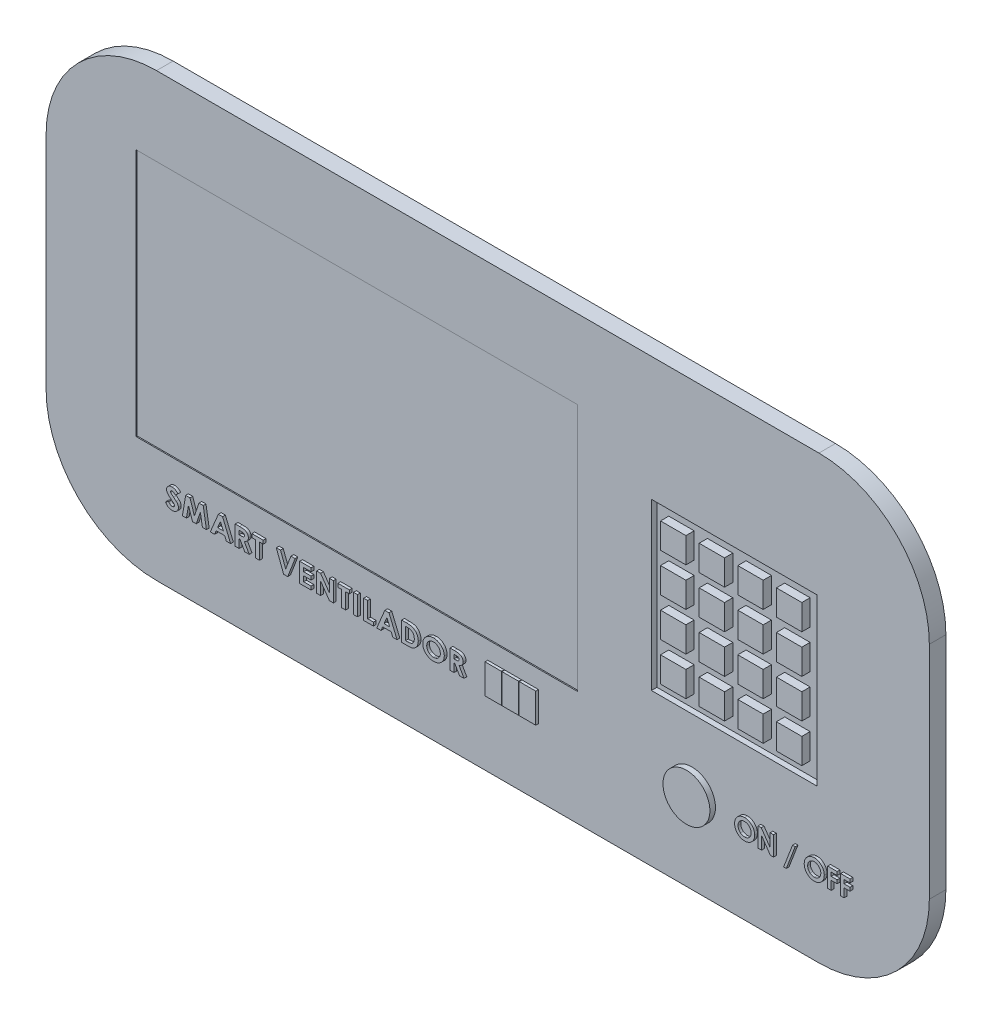
from build123d import *

# Parameters (mm, degrees)
SALIENTE_EXTRUIR1_DEPTH = 3
CROQUIS2_W              = 0.717948718
CROQUIS2_H              = 3.5
SALIENTE_EXTRUIR2_DEPTH = 0.5
SALIENTE_EXTRUIR3_DEPTH = 0.5
CROQUIS4_W              = 3
CROQUIS4_H              = 5.35
SALIENTE_EXTRUIR4_DEPTH = 0.5
CROQUIS5_W              = 80
CROQUIS5_H              = 45
CORTAR_EXTRUIR1_DEPTH   = 0.2
CROQUIS6_R              = 4.25
SALIENTE_EXTRUIR5_DEPTH = 1
CROQUIS7_W              = 30
CROQUIS7_H              = 30
CORTAR_EXTRUIR2_DEPTH   = 1
CROQUIS8_W              = 4.6
CROQUIS8_H              = 4.6
SALIENTE_EXTRUIR6_DEPTH = 1.5


with BuildPart() as part:
    # Croquis1 → Saliente-Extruir1 (new body)
    with BuildSketch(Plane.XY):
        with BuildLine():
            Line((-60, 40), (60, 40))
            ThreePointArc((60, 40), (74.142135624, 34.142135624), (80, 20))
            Line((80, 20), (80, -20))
            ThreePointArc((80, -20), (74.142135624, -34.142135624), (60, -40))
            Line((60, -40), (-60, -40))
            ThreePointArc((-60, -40), (-74.142135624, -34.142135624), (-80, -20))
            Line((-80, -20), (-80, 20))
            ThreePointArc((-80, 20), (-74.142135624, 34.142135624), (-60, 40))
        make_face()
    extrude(amount=SALIENTE_EXTRUIR1_DEPTH)

    # Croquis2 → Saliente-Extruir2 (add)
    # profile 1 of 15: a face of its own
    with BuildSketch(Plane.XY.offset(3)):
        with BuildLine():
            Line((-55.621794872, -23.967648237), (-56.124499199, -24.397435897))
            add(Edge.make_bspline(
                [(-56.124499199, -24.397435897), (-56.146289856, -24.369052903), (-56.188135035, -24.314548283), (-56.25497565, -24.241417992), (-56.321613686, -24.178938925), (-56.389157899, -24.127891339), (-56.457402581, -24.088145818), (-56.525956881, -24.059708882), (-56.594969249, -24.041735408), (-56.641356448, -24.039546945), (-56.664362981, -24.038461538)],
                knots=[0, 0, 0, 0, 1.277318712, 2.45286911, 3.533588782, 4.535065184, 5.46981375, 6.345469513, 7.179407024, 8, 8, 8, 8], degree=3))
            add(Edge.make_bspline(
                [(-56.664362981, -24.038461538), (-56.685708, -24.039134703), (-56.726753785, -24.040429176), (-56.785411939, -24.054125009), (-56.837942834, -24.076617586), (-56.883402375, -24.107395247), (-56.919967376, -24.143408068), (-56.948410812, -24.181892879), (-56.964226243, -24.224287201), (-56.966717538, -24.253360534), (-56.967948718, -24.267728365)],
                knots=[0, 0, 0, 0, 1.217479296, 2.341173553, 3.417477448, 4.465338837, 5.456563799, 6.338062097, 7.178682312, 8, 8, 8, 8], degree=3))
            add(Edge.make_bspline(
                [(-56.967948718, -24.267728365), (-56.967009562, -24.282279816), (-56.965119584, -24.311563489), (-56.953687441, -24.354965153), (-56.933634537, -24.39668002), (-56.915522489, -24.422220823), (-56.90625, -24.435296474)],
                knots=[0, 0, 0, 0, 0.961387754, 1.934718672, 2.942676219, 4, 4, 4, 4], degree=3))
            add(Edge.make_bspline(
                [(-56.90625, -24.435296474), (-56.897475032, -24.445443587), (-56.8773462, -24.468719972), (-56.839966216, -24.505985803), (-56.792711248, -24.551312586), (-56.73411001, -24.603713536), (-56.665633125, -24.664052852), (-56.585804218, -24.73140971), (-56.495945341, -24.806807025), (-56.432106155, -24.859299305), (-56.398637821, -24.88681891)],
                knots=[0, 0, 0, 0, 0.473340372, 1.085791838, 1.861725834, 2.784458208, 3.859937724, 5.082978446, 6.470722139, 8, 8, 8, 8], degree=3))
            add(Edge.make_bspline(
                [(-56.398637821, -24.88681891), (-56.367365202, -24.912346913), (-56.307902408, -24.960886702), (-56.222817611, -25.02895694), (-56.14876769, -25.091314709), (-56.083233629, -25.144587126), (-56.028757454, -25.192132522), (-55.982907862, -25.231042236), (-55.94721146, -25.263154834), (-55.926982844, -25.282449354), (-55.918369391, -25.290665064)],
                knots=[0, 0, 0, 0, 1.543675599, 2.93519593, 4.166390145, 5.245405028, 6.164324761, 6.931062555, 7.544840672, 8, 8, 8, 8], degree=3))
            add(Edge.make_bspline(
                [(-55.918369391, -25.290665064), (-55.885307432, -25.324027525), (-55.82196052, -25.387950201), (-55.7400681, -25.488103721), (-55.671208768, -25.584606887), (-55.619286054, -25.681766822), (-55.580173713, -25.779444659), (-55.551371343, -25.880075893), (-55.535469285, -25.985433689), (-55.533199129, -26.057175217), (-55.532051282, -26.093449519)],
                knots=[0, 0, 0, 0, 1.227179859, 2.351284024, 3.378339862, 4.321367522, 5.223305034, 6.124621562, 7.051761985, 8, 8, 8, 8], degree=3))
            add(Edge.make_bspline(
                [(-55.532051282, -26.093449519), (-55.532948725, -26.128793717), (-55.534710133, -26.198163628), (-55.549946823, -26.299891443), (-55.57419614, -26.396801614), (-55.608795548, -26.489155011), (-55.65435804, -26.576108706), (-55.707965454, -26.65967524), (-55.773666543, -26.736640245), (-55.846628631, -26.809722689), (-55.928573554, -26.874969173), (-56.016483024, -26.933116888), (-56.110877326, -26.981444891), (-56.211416346, -27.021013696), (-56.317860466, -27.051443209), (-56.430102551, -27.074099574), (-56.548345125, -27.087607188), (-56.629271305, -27.089020527), (-56.670673077, -27.08974359)],
                knots=[0, 0, 0, 0, 0.999766624, 1.962237841, 2.90384921, 3.82270094, 4.745614044, 5.677512525, 6.625951363, 7.603395152, 8.596026376, 9.584772012, 10.581624785, 11.591187941, 12.637768575, 13.710459695, 14.828672936, 16, 16, 16, 16], degree=3))
            add(Edge.make_bspline(
                [(-56.670673077, -27.08974359), (-56.703176817, -27.089217749), (-56.767360292, -27.088179398), (-56.861969011, -27.079567785), (-56.953329077, -27.065688977), (-57.041404863, -27.045967813), (-57.126450099, -27.02069371), (-57.208533337, -26.989940404), (-57.287284149, -26.953377679), (-57.362850669, -26.911094006), (-57.435238015, -26.8624943), (-57.504855089, -26.807646704), (-57.571531972, -26.746159084), (-57.636403669, -26.678885064), (-57.697615102, -26.604360338), (-57.757027279, -26.524139134), (-57.812975486, -26.436968651), (-57.847680101, -26.375704797), (-57.865384615, -26.344451122)],
                knots=[0, 0, 0, 0, 1.047498313, 2.068441419, 3.059231922, 4.024170881, 4.975130488, 5.916735576, 6.846911781, 7.770998236, 8.70488822, 9.654295141, 10.62465836, 11.626271271, 12.664055072, 13.730743618, 14.842341825, 16, 16, 16, 16], degree=3))
            Line((-57.865384615, -26.344451122), (-57.280649038, -26.012820513))
            add(Edge.make_bspline(
                [(-57.280649038, -26.012820513), (-57.258849225, -26.048304191), (-57.216972833, -26.116466628), (-57.146506653, -26.207835884), (-57.074332303, -26.285754338), (-56.999642452, -26.349882612), (-56.92189244, -26.399871584), (-56.841235638, -26.435248222), (-56.758099105, -26.457514661), (-56.701655962, -26.460198563), (-56.673477564, -26.461538462)],
                knots=[0, 0, 0, 0, 1.263139482, 2.426430153, 3.495266246, 4.48153534, 5.406311373, 6.289232501, 7.145924809, 8, 8, 8, 8], degree=3))
            add(Edge.make_bspline(
                [(-56.673477564, -26.461538462), (-56.644611798, -26.460427934), (-56.588553277, -26.458271242), (-56.50847831, -26.438670575), (-56.435087107, -26.407823413), (-56.371715304, -26.363592617), (-56.318347924, -26.312523326), (-56.278505191, -26.255952761), (-56.254501415, -26.194111778), (-56.25150506, -26.151374612), (-56.25, -26.129907853)],
                knots=[0, 0, 0, 0, 1.163832301, 2.260210803, 3.308505476, 4.360742954, 5.361758128, 6.277907902, 7.134997948, 8, 8, 8, 8], degree=3))
            add(Edge.make_bspline(
                [(-56.25, -26.129907853), (-56.251053154, -26.109913324), (-56.25319924, -26.069169086), (-56.272198552, -26.008810139), (-56.301357619, -25.948683936), (-56.334962444, -25.899221318), (-56.36915887, -25.857510997), (-56.403101085, -25.82237622), (-56.44285038, -25.782162626), (-56.490221528, -25.738823552), (-56.544215052, -25.691417385), (-56.60440172, -25.639060929), (-56.672627629, -25.58424669), (-56.720215817, -25.546101686), (-56.744991987, -25.526241987)],
                knots=[0, 0, 0, 0, 0.892402583, 1.818510659, 2.804945013, 3.874697065, 4.483648646, 5.215708092, 6.058298861, 7.012472764, 8.086251532, 9.272156419, 10.579783825, 12, 12, 12, 12], degree=3))
            add(Edge.make_bspline(
                [(-56.744991987, -25.526241987), (-56.792595144, -25.488580671), (-56.883801312, -25.416422761), (-57.012482935, -25.309445746), (-57.1282728, -25.209257028), (-57.231319178, -25.115932348), (-57.320538304, -25.028596536), (-57.397498672, -24.949037383), (-57.460855337, -24.875621628), (-57.526514531, -24.788161755), (-57.589860792, -24.682245905), (-57.644464019, -24.554229067), (-57.679918898, -24.426214145), (-57.683927776, -24.340158058), (-57.685897436, -24.297876603)],
                knots=[0, 0, 0, 0, 1.365689936, 2.616619431, 3.764752617, 4.810693309, 5.744036183, 6.573410299, 7.300607496, 7.924251543, 9.032571599, 10.066881874, 11.050211877, 12, 12, 12, 12], degree=3))
            add(Edge.make_bspline(
                [(-57.685897436, -24.297876603), (-57.685252341, -24.267897142), (-57.683979896, -24.208762954), (-57.668940926, -24.12192614), (-57.646929887, -24.038089329), (-57.615077998, -23.957638929), (-57.573918159, -23.880672583), (-57.52397253, -23.806805574), (-57.464605843, -23.73648345), (-57.396962419, -23.670306604), (-57.322540274, -23.610146588), (-57.243769314, -23.555987631), (-57.159796657, -23.511319482), (-57.072140727, -23.473970396), (-56.980127657, -23.444934379), (-56.883837145, -23.424808468), (-56.783159403, -23.412750318), (-56.714643344, -23.411097325), (-56.67978766, -23.41025641)],
                knots=[0, 0, 0, 0, 0.963119029, 1.899742706, 2.825934193, 3.747110609, 4.675130108, 5.627810591, 6.609404785, 7.629881686, 8.666397204, 9.683713782, 10.699279647, 11.719756548, 12.744294213, 13.79681864, 14.879191321, 16, 16, 16, 16], degree=3))
            add(Edge.make_bspline(
                [(-56.67978766, -23.41025641), (-56.634587808, -23.411762324), (-56.544798192, -23.414753825), (-56.412132871, -23.438090378), (-56.282727228, -23.4753693), (-56.177833707, -23.519282189), (-56.094673672, -23.563292532), (-56.030307968, -23.602325975), (-55.965302292, -23.648471373), (-55.898169078, -23.699329681), (-55.831367999, -23.758336927), (-55.761687897, -23.821642087), (-55.691581219, -23.892124724), (-55.645472562, -23.942023994), (-55.621794872, -23.967648237)],
                knots=[0, 0, 0, 0, 1.316312799, 2.614858576, 3.91215405, 5.233669687, 5.919003686, 6.652379443, 7.424978738, 8.240779349, 9.104907034, 10.020538666, 10.983508212, 12, 12, 12, 12], degree=3))
        make_face()
    # profile 2 of 15: a face of its own
    with BuildSketch(Plane.XY.offset(3)):
        Polygon((-54.222075321, -23.5), (-53.447335737, -23.5), (-52.633333333, -25.94130609), (-51.815825321, -23.5), (-51.044591346, -23.5), (-50.457051282, -27), (-51.185516827, -27), (-51.556410256, -24.789362981), (-52.296794872, -27), (-52.973377404, -27), (-53.71025641, -24.789362981), (-54.08114984, -27), (-54.809615385, -27), align=None)
    # profile 3 of 15: a face of its own
    with BuildSketch(Plane.XY.offset(3)):
        Polygon((-48.295913462, -23.5), (-47.538000801, -23.5), (-46.077564103, -27), (-46.848096955, -27), (-47.144671474, -26.282051282), (-48.689242788, -26.282051282), (-48.986518429, -27), (-49.757051282, -27), align=None)
        Polygon((-47.917307692, -24.438802083), (-48.428425481, -25.653846154), (-47.405488782, -25.653846154), align=None, mode=Mode.SUBTRACT)
    # profile 4 of 15: a face of its own
    with BuildSketch(Plane.XY.offset(3)):
        with BuildLine():
            Line((-45.242948718, -23.5), (-44.434555288, -23.5))
            add(Edge.make_bspline(
                [(-44.434555288, -23.5), (-44.381265107, -23.500175455), (-44.278632901, -23.500513366), (-44.130665267, -23.50568712), (-43.99433399, -23.513039221), (-43.870110327, -23.52389994), (-43.757874139, -23.538732198), (-43.657705195, -23.55600658), (-43.568980481, -23.575772154), (-43.491022503, -23.600042918), (-43.420856154, -23.628026155), (-43.355416826, -23.659550691), (-43.29346326, -23.69563823), (-43.234550609, -23.735258013), (-43.179597542, -23.77978462), (-43.128302073, -23.828546519), (-43.079767227, -23.880839033), (-43.035705744, -23.937791703), (-42.99602803, -23.997861877), (-42.960271026, -24.060511138), (-42.931347988, -24.126567713), (-42.906347379, -24.194786083), (-42.887490806, -24.265906832), (-42.874251013, -24.339534118), (-42.866447877, -24.415964307), (-42.865319344, -24.46776372), (-42.86474359, -24.494190705)],
                knots=[0, 0, 0, 0, 1.810401764, 3.486674673, 5.029519145, 6.448546818, 7.721978868, 8.874627388, 9.901230509, 10.807823259, 11.645301282, 12.465628286, 13.273214053, 14.079237002, 14.87534365, 15.672913984, 16.482098508, 17.29687332, 18.116085201, 18.926632022, 19.744110526, 20.562899031, 21.393004911, 22.24024988, 23.102212043, 24, 24, 24, 24], degree=3))
            add(Edge.make_bspline(
                [(-42.86474359, -24.494190705), (-42.865277465, -24.521787566), (-42.866325172, -24.57594527), (-42.874702614, -24.655488775), (-42.889511733, -24.731427067), (-42.909971812, -24.80409851), (-42.935655738, -24.873449017), (-42.967609643, -24.939395684), (-43.005274263, -25.001710069), (-43.049425298, -25.060217987), (-43.098206122, -25.115795368), (-43.153745284, -25.167215024), (-43.21442884, -25.215665542), (-43.281762551, -25.259625991), (-43.354067033, -25.301386036), (-43.432750456, -25.338886201), (-43.516967545, -25.37349185), (-43.575784557, -25.392920204), (-43.605829327, -25.402844551)],
                knots=[0, 0, 0, 0, 1.043198031, 2.047233251, 3.01934853, 3.964797548, 4.898614941, 5.811463997, 6.731256592, 7.646625036, 8.579229433, 9.523149634, 10.504257845, 11.511437172, 12.560232801, 13.658834121, 14.804091076, 16, 16, 16, 16], degree=3))
            Line((-43.605829327, -25.402844551), (-42.707692308, -27))
            Line((-42.707692308, -27), (-43.516786859, -27))
            Line((-43.516786859, -27), (-44.374959936, -25.474358974))
            Line((-44.374959936, -25.474358974), (-44.525, -25.474358974))
            Line((-44.525, -25.474358974), (-44.525, -27))
            Line((-44.525, -27), (-45.242948718, -27))
            Line((-45.242948718, -27), (-45.242948718, -23.5))
        make_face()
        with BuildLine():
            Line((-44.525, -24.846153846), (-44.268389423, -24.846153846))
            add(Edge.make_bspline(
                [(-44.268389423, -24.846153846), (-44.237071472, -24.845817383), (-44.176985908, -24.845171855), (-44.090408914, -24.842157457), (-44.011610482, -24.835005721), (-43.940308176, -24.825797843), (-43.876558454, -24.815495782), (-43.820773726, -24.800237994), (-43.772105192, -24.784052005), (-43.730652697, -24.764222204), (-43.69541783, -24.741216654), (-43.664877222, -24.715344442), (-43.639505477, -24.685290038), (-43.617896401, -24.652405244), (-43.60296089, -24.614982636), (-43.590747108, -24.575232984), (-43.583613224, -24.531601574), (-43.583007509, -24.501461499), (-43.582692308, -24.485777244)],
                knots=[0, 0, 0, 0, 1.708363675, 3.277608857, 4.723712974, 6.021838054, 7.199660436, 8.241690857, 9.172961181, 9.993967569, 10.739999558, 11.46313589, 12.168296226, 12.87908003, 13.598837728, 14.357076655, 15.145057537, 16, 16, 16, 16], degree=3))
            add(Edge.make_bspline(
                [(-43.582692308, -24.485777244), (-43.583336018, -24.467209088), (-43.584602537, -24.43067567), (-43.599535983, -24.378341143), (-43.62204024, -24.329279661), (-43.654852889, -24.285602051), (-43.694278284, -24.245850119), (-43.740851398, -24.212329472), (-43.793446601, -24.184692941), (-43.842302226, -24.167102448), (-43.886985236, -24.156141878), (-43.927224607, -24.148536479), (-43.974072094, -24.142480076), (-44.026881891, -24.136801518), (-44.086283572, -24.132702433), (-44.151978891, -24.129955443), (-44.224214644, -24.128766607), (-44.274465631, -24.12839743), (-44.300641026, -24.128205128)],
                knots=[0, 0, 0, 0, 0.985252127, 1.938513972, 2.873098658, 3.843165384, 4.828025027, 5.842890392, 6.883115312, 7.980634618, 8.595920604, 9.330050158, 10.158404267, 11.108741491, 12.156004298, 13.326020887, 14.60714262, 16, 16, 16, 16], degree=3))
            Line((-44.300641026, -24.128205128), (-44.525, -24.128205128))
            Line((-44.525, -24.128205128), (-44.525, -24.846153846))
        make_face(mode=Mode.SUBTRACT)
    # profile 5 of 15: a face of its own
    with BuildSketch(Plane.XY.offset(3)):
        Polygon((-42.232051282, -23.5), (-40.167948718, -23.5), (-40.167948718, -24.128205128), (-40.841025641, -24.128205128), (-40.841025641, -27), (-41.558974359, -27), (-41.558974359, -24.128205128), (-42.232051282, -24.128205128), align=None)
    # profile 6 of 15: a face of its own
    with BuildSketch(Plane.XY.offset(3)):
        Polygon((-37.803205128, -23.5), (-37.045292468, -23.5), (-36.098076923, -25.986177885), (-35.150160256, -23.5), (-34.392948718, -23.5), (-35.728585737, -27), (-36.469671474, -27), align=None)
    # profile 7 of 15: a face of its own
    with BuildSketch(Plane.XY.offset(3)):
        Polygon((-33.558333333, -23.5), (-31.494230769, -23.5), (-31.494230769, -24.128205128), (-32.840384615, -24.128205128), (-32.840384615, -24.801282051), (-31.494230769, -24.801282051), (-31.494230769, -25.429487179), (-32.840384615, -25.429487179), (-32.840384615, -26.371794872), (-31.494230769, -26.371794872), (-31.494230769, -27), (-33.558333333, -27), align=None)
    # profile 8 of 15: a face of its own
    with BuildSketch(Plane.XY.offset(3)):
        Polygon((-30.502564103, -23.5), (-29.784615385, -23.5), (-28.169230769, -25.803185096), (-28.169230769, -23.5), (-27.451282051, -23.5), (-27.451282051, -27), (-28.174138622, -27), (-29.784615385, -24.703826122), (-29.784615385, -27), (-30.502564103, -27), align=None)
    # profile 9 of 15: a face of its own
    with BuildSketch(Plane.XY.offset(3)):
        Polygon((-26.639102564, -23.5), (-24.575, -23.5), (-24.575, -24.128205128), (-25.248076923, -24.128205128), (-25.248076923, -27), (-25.966025641, -27), (-25.966025641, -24.128205128), (-26.639102564, -24.128205128), align=None)
    # profile 10 of 15: a face of its own
    with BuildSketch(Plane.XY.offset(3)):
        with Locations((-23.448717949, -25.25)):
            Rectangle(CROQUIS2_W, CROQUIS2_H)
    # profile 11 of 15: a face of its own
    with BuildSketch(Plane.XY.offset(3)):
        Polygon((-21.963461538, -23.5), (-21.245512821, -23.5), (-21.245512821, -26.371794872), (-20.213461538, -26.371794872), (-20.213461538, -27), (-21.963461538, -27), align=None)
    # profile 12 of 15: a face of its own
    with BuildSketch(Plane.XY.offset(3)):
        Polygon((-18.142067308, -23.5), (-17.384154647, -23.5), (-15.923717949, -27), (-16.694250801, -27), (-16.990825321, -26.282051282), (-18.535396635, -26.282051282), (-18.832672276, -27), (-19.603205128, -27), align=None)
        Polygon((-17.763461538, -24.438802083), (-18.274579327, -25.653846154), (-17.251642628, -25.653846154), align=None, mode=Mode.SUBTRACT)
    # profile 13 of 15: a face of its own
    with BuildSketch(Plane.XY.offset(3)):
        with BuildLine():
            Line((-15.089102564, -23.5), (-14.233733974, -23.5))
            add(Edge.make_bspline(
                [(-14.233733974, -23.5), (-14.167115878, -23.500440041), (-14.038019366, -23.50129278), (-13.851172702, -23.510604157), (-13.677398484, -23.525141864), (-13.517020687, -23.544900338), (-13.369748206, -23.571440439), (-13.235954914, -23.603997662), (-13.11523895, -23.642541745), (-13.006167626, -23.686839375), (-12.906658687, -23.739404228), (-12.812176127, -23.797553853), (-12.722509227, -23.863602285), (-12.637169505, -23.93693004), (-12.556419678, -24.01787888), (-12.480017709, -24.1061978), (-12.408543125, -24.202072298), (-12.341190839, -24.304013839), (-12.280380071, -24.412095913), (-12.227696191, -24.525643104), (-12.182676845, -24.643413628), (-12.1463217, -24.766076498), (-12.117455275, -24.892974439), (-12.097277451, -25.024410198), (-12.085193718, -25.160262092), (-12.083535015, -25.252312227), (-12.082692308, -25.299078526)],
                knots=[0, 0, 0, 0, 1.494078584, 2.895314429, 4.194726073, 5.404700159, 6.518210919, 7.549273854, 8.490856347, 9.358190944, 10.185824783, 11.01206306, 11.844513431, 12.680866051, 13.533374415, 14.406691734, 15.29780874, 16.213741172, 17.145466963, 18.07648471, 19.018854785, 19.970798204, 20.943612606, 21.93555847, 22.95115539, 24, 24, 24, 24], degree=3))
            add(Edge.make_bspline(
                [(-12.082692308, -25.299078526), (-12.084385202, -25.365081884), (-12.087719972, -25.495099473), (-12.115837034, -25.685863659), (-12.161238187, -25.868758476), (-12.225295063, -26.04208324), (-12.303767102, -26.204966693), (-12.398321804, -26.353557636), (-12.506210158, -26.488135732), (-12.627351514, -26.60667599), (-12.757680651, -26.709560333), (-12.894126352, -26.796648146), (-13.036654089, -26.865975127), (-13.162033234, -26.909363105), (-13.270866491, -26.936930779), (-13.366414268, -26.95272168), (-13.475314811, -26.967747647), (-13.598166392, -26.979006885), (-13.734637039, -26.989235262), (-13.884776542, -26.994759812), (-14.048375565, -26.999369193), (-14.161981668, -26.999784061), (-14.221113782, -27)],
                knots=[0, 0, 0, 0, 1.259954248, 2.481937546, 3.673749466, 4.852781836, 6.004533842, 7.120124249, 8.208893917, 9.291425112, 10.349538388, 11.374759778, 12.37682138, 13.36910449, 13.902767555, 14.519139419, 15.217253139, 16.001986812, 16.874547636, 17.830513077, 18.870779437, 20, 20, 20, 20], degree=3))
            Line((-14.221113782, -27), (-15.089102564, -27))
            Line((-15.089102564, -27), (-15.089102564, -23.5))
        make_face()
        with BuildLine():
            Line((-14.371153846, -24.128205128), (-14.371153846, -26.371794872))
            Line((-14.371153846, -26.371794872), (-14.033914263, -26.371794872))
            add(Edge.make_bspline(
                [(-14.033914263, -26.371794872), (-13.993704364, -26.371720764), (-13.916279183, -26.371578068), (-13.804591698, -26.365050097), (-13.701305501, -26.358446668), (-13.606687144, -26.345933026), (-13.520049075, -26.332138277), (-13.442607731, -26.312648738), (-13.37293984, -26.292489306), (-13.311761484, -26.26650573), (-13.255726005, -26.237163866), (-13.20327454, -26.203482696), (-13.153099363, -26.165283512), (-13.105516099, -26.122811234), (-13.06131997, -26.075170377), (-13.018862434, -26.024048773), (-12.979718256, -25.967483223), (-12.942824585, -25.906935021), (-12.908685442, -25.842434031), (-12.880470513, -25.773629266), (-12.855601119, -25.701601924), (-12.835272514, -25.62596695), (-12.820073887, -25.546478663), (-12.808922419, -25.463389795), (-12.801628614, -25.3767997), (-12.800973365, -25.317790001), (-12.800641026, -25.287860577)],
                knots=[0, 0, 0, 0, 1.523669709, 2.933864728, 4.239623319, 5.444890021, 6.550182806, 7.56208441, 8.469926649, 9.295760893, 10.07631634, 10.865071544, 11.655218202, 12.464400176, 13.279042311, 14.116059622, 14.981059707, 15.883440539, 16.80262051, 17.743607914, 18.698829689, 19.68937621, 20.709117789, 21.763920273, 22.865871542, 24, 24, 24, 24], degree=3))
            add(Edge.make_bspline(
                [(-12.800641026, -25.287860577), (-12.801795131, -25.242014036), (-12.804045335, -25.152625322), (-12.819303878, -25.022278692), (-12.845968965, -24.89972513), (-12.883039503, -24.785002249), (-12.93055445, -24.678033878), (-12.990623732, -24.580323287), (-13.058658021, -24.48838639), (-13.113267077, -24.435304905), (-13.140685096, -24.408653846)],
                knots=[0, 0, 0, 0, 1.132793406, 2.208649617, 3.237138899, 4.226931707, 5.183258886, 6.121135875, 7.056663184, 8, 8, 8, 8], degree=3))
            add(Edge.make_bspline(
                [(-13.140685096, -24.408653846), (-13.167686105, -24.38589392), (-13.222710946, -24.339511899), (-13.318325142, -24.283376889), (-13.424073668, -24.2344774), (-13.542096734, -24.195782766), (-13.671289041, -24.164948743), (-13.812267233, -24.143866178), (-13.964465887, -24.130197716), (-14.069873194, -24.12888413), (-14.124358974, -24.128205128)],
                knots=[0, 0, 0, 0, 0.809370818, 1.64940136, 2.535194483, 3.480162931, 4.495135713, 5.58092784, 6.749564542, 8, 8, 8, 8], degree=3))
            Line((-14.124358974, -24.128205128), (-14.371153846, -24.128205128))
        make_face(mode=Mode.SUBTRACT)
    # profile 14 of 15: a face of its own
    with BuildSketch(Plane.XY.offset(3)):
        with BuildLine():
            add(Edge.make_bspline(
                [(-9.310877404, -23.41025641), (-9.245590426, -23.41183385), (-9.116622242, -23.41494993), (-8.926933465, -23.44085525), (-8.744223954, -23.482788879), (-8.568635489, -23.542172451), (-8.399822241, -23.617866054), (-8.23837791, -23.711439702), (-8.083650393, -23.820935467), (-7.938540025, -23.946717266), (-7.804564749, -24.083115991), (-7.687498586, -24.229459884), (-7.588968719, -24.383431862), (-7.506422489, -24.543723881), (-7.444132904, -24.712725905), (-7.399136318, -24.888644483), (-7.371873427, -25.072233743), (-7.368420677, -25.197089574), (-7.366666667, -25.260516827)],
                knots=[0, 0, 0, 0, 1.049696402, 2.073574885, 3.072906237, 4.060690321, 5.04995375, 6.043499802, 7.057254493, 8.094057568, 9.12807687, 10.128390374, 11.102251621, 12.063819208, 13.022458253, 13.992481724, 14.980172828, 16, 16, 16, 16], degree=3))
            add(Edge.make_bspline(
                [(-7.366666667, -25.260516827), (-7.368492357, -25.323236969), (-7.372091511, -25.446883058), (-7.398374579, -25.628619092), (-7.442560798, -25.803101475), (-7.505515169, -25.969743308), (-7.585112963, -26.129591794), (-7.683210773, -26.281474162), (-7.7991837, -26.425780526), (-7.930557875, -26.561311217), (-8.074866142, -26.684520942), (-8.228026734, -26.793316836), (-8.389433547, -26.884555986), (-8.55793463, -26.960471327), (-8.734499069, -27.01852903), (-8.918329075, -27.059837069), (-9.109660605, -27.084961584), (-9.239753736, -27.088130599), (-9.305969551, -27.08974359)],
                knots=[0, 0, 0, 0, 1.014050959, 1.999093624, 2.962474041, 3.919248956, 4.874193364, 5.844951248, 6.837131159, 7.863453727, 8.892777976, 9.901511838, 10.896710297, 11.886360502, 12.885490882, 13.896784394, 14.929488937, 16, 16, 16, 16], degree=3))
            add(Edge.make_bspline(
                [(-9.305969551, -27.08974359), (-9.375008423, -27.088291799), (-9.510554411, -27.085441458), (-9.709149767, -27.05812464), (-9.899532131, -27.017235428), (-10.080215407, -26.955959934), (-10.252629891, -26.879751533), (-10.415281427, -26.784791757), (-10.569479181, -26.673684892), (-10.712752381, -26.546646581), (-10.842831468, -26.408271166), (-10.957455281, -26.26191399), (-11.05378386, -26.108597758), (-11.132987114, -25.948899842), (-11.195210409, -25.78316189), (-11.238294393, -25.610473675), (-11.266229058, -25.431802797), (-11.269073149, -25.310168669), (-11.270512821, -25.248597756)],
                knots=[0, 0, 0, 0, 1.104586766, 2.168666752, 3.203450315, 4.217361517, 5.217176418, 6.21629109, 7.226606606, 8.255013025, 9.276660051, 10.26302175, 11.226301965, 12.16996216, 13.11228646, 14.054165042, 15.015022858, 16, 16, 16, 16], degree=3))
            add(Edge.make_bspline(
                [(-11.270512821, -25.248597756), (-11.269651696, -25.207204372), (-11.267940501, -25.124948905), (-11.255839161, -25.002866017), (-11.235650118, -24.883327473), (-11.206465321, -24.766577319), (-11.170354647, -24.652025237), (-11.124891718, -24.540329029), (-11.072595941, -24.430618131), (-11.011247185, -24.324426444), (-10.943983444, -24.221627635), (-10.868976747, -24.124556215), (-10.788455673, -24.032496831), (-10.701342532, -23.946250725), (-10.608319395, -23.865612829), (-10.510278383, -23.789119478), (-10.404536733, -23.720289994), (-10.294243443, -23.655890436), (-10.179860861, -23.597476314), (-10.061799015, -23.548383894), (-9.942386308, -23.504631261), (-9.820018286, -23.470987487), (-9.695922658, -23.442910277), (-9.569295599, -23.424727916), (-9.440852154, -23.41183422), (-9.354379952, -23.410784503), (-9.310877404, -23.41025641)],
                knots=[0, 0, 0, 0, 0.997678596, 1.982551546, 2.954058229, 3.917298017, 4.881130648, 5.846673895, 6.821767171, 7.808378587, 8.800523032, 9.780793558, 10.762778381, 11.746684189, 12.732909544, 13.728980508, 14.741436122, 15.771402875, 16.806854874, 17.834307421, 18.851765781, 19.870097094, 20.891120496, 21.916470583, 22.951815307, 24, 24, 24, 24], degree=3))
        make_face()
        with BuildLine():
            add(Edge.make_bspline(
                [(-9.321394231, -24.038461538), (-9.363982299, -24.0395518), (-9.447832752, -24.041698384), (-9.570804888, -24.05826183), (-9.688813221, -24.084622187), (-9.801426864, -24.122875871), (-9.909094202, -24.171249157), (-10.011566728, -24.230626805), (-10.108464839, -24.30101369), (-10.199109063, -24.381505835), (-10.282207388, -24.469442718), (-10.354274515, -24.565102058), (-10.415430558, -24.666103175), (-10.465536208, -24.773069339), (-10.505375122, -24.885641786), (-10.531864996, -25.004577872), (-10.549615725, -25.128874415), (-10.55156778, -25.213710923), (-10.552564103, -25.257011218)],
                knots=[0, 0, 0, 0, 1.055204393, 2.077562293, 3.069591117, 4.047707093, 5.019870956, 5.990497881, 6.977627683, 7.982959847, 8.991041444, 9.971093488, 10.945584032, 11.912071583, 12.893953377, 13.898567786, 14.927435399, 16, 16, 16, 16], degree=3))
            add(Edge.make_bspline(
                [(-10.552564103, -25.257011218), (-10.551271287, -25.305001276), (-10.54873573, -25.399122627), (-10.527275676, -25.536241973), (-10.492394087, -25.665769954), (-10.442569743, -25.787154188), (-10.380464559, -25.901861636), (-10.302036962, -26.007159969), (-10.211414419, -26.106254736), (-10.141094794, -26.163252366), (-10.105248397, -26.192307692)],
                knots=[0, 0, 0, 0, 1.069242721, 2.097071222, 3.085376775, 4.052797002, 5.015732193, 5.984778196, 6.972712951, 8, 8, 8, 8], degree=3))
            add(Edge.make_bspline(
                [(-10.105248397, -26.192307692), (-10.076162771, -26.213875259), (-10.018438342, -26.256679062), (-9.926126916, -26.311019686), (-9.831099917, -26.357809655), (-9.732721781, -26.395589889), (-9.631205614, -26.425300124), (-9.526344166, -26.446189761), (-9.418242888, -26.459175474), (-9.345035114, -26.460745676), (-9.308072917, -26.461538462)],
                knots=[0, 0, 0, 0, 1.013047639, 2.010532423, 2.993667268, 3.975386105, 4.956756072, 5.951146405, 6.965545226, 8, 8, 8, 8], degree=3))
            add(Edge.make_bspline(
                [(-9.308072917, -26.461538462), (-9.266421699, -26.460436256), (-9.184437628, -26.458266731), (-9.063705389, -26.441815916), (-8.94795747, -26.414553165), (-8.836767764, -26.376457491), (-8.730394784, -26.327018136), (-8.628632482, -26.266721732), (-8.532065884, -26.195051157), (-8.440856921, -26.114322515), (-8.357015658, -26.02568753), (-8.284935011, -25.929604525), (-8.22231683, -25.829629756), (-8.171603475, -25.724101644), (-8.133040522, -25.612936768), (-8.105074892, -25.497208805), (-8.087665977, -25.376260807), (-8.085644701, -25.293995963), (-8.084615385, -25.252103365)],
                knots=[0, 0, 0, 0, 1.042754808, 2.05250381, 3.044734659, 4.016369353, 4.99039802, 5.977003884, 6.973093156, 7.997105831, 9.023907439, 10.022314898, 10.999976081, 11.973705823, 12.947259684, 13.940853027, 14.951398795, 16, 16, 16, 16], degree=3))
            add(Edge.make_bspline(
                [(-8.084615385, -25.252103365), (-8.085656387, -25.210445433), (-8.087706236, -25.128416316), (-8.105019093, -25.007920385), (-8.133026213, -24.892349767), (-8.172261461, -24.781423231), (-8.224112525, -24.676108523), (-8.285881555, -24.574874586), (-8.360198267, -24.479647326), (-8.443806286, -24.389645375), (-8.535429044, -24.30750621), (-8.63350235, -24.235679973), (-8.735791424, -24.174227385), (-8.843610065, -24.124808149), (-8.956160167, -24.086300336), (-9.073435636, -24.057984123), (-9.195904745, -24.041756791), (-9.279045927, -24.039573571), (-9.321394231, -24.038461538)],
                knots=[0, 0, 0, 0, 1.03575694, 2.039520994, 3.020797989, 3.989755797, 4.959480517, 5.935526576, 6.934295908, 7.95845522, 8.987666614, 9.98988092, 10.977832937, 11.950601889, 12.934097473, 13.932325338, 14.946821381, 16, 16, 16, 16], degree=3))
        make_face(mode=Mode.SUBTRACT)
    # profile 15 of 15: a face of its own
    with BuildSketch(Plane.XY.offset(3)):
        with BuildLine():
            Line((-6.330128205, -23.5), (-5.521734776, -23.5))
            add(Edge.make_bspline(
                [(-5.521734776, -23.5), (-5.468444594, -23.500175455), (-5.365812388, -23.500513366), (-5.217844754, -23.50568712), (-5.081513477, -23.513039221), (-4.957289814, -23.52389994), (-4.845053626, -23.538732198), (-4.744884682, -23.55600658), (-4.656159968, -23.575772154), (-4.578201991, -23.600042918), (-4.508035641, -23.628026155), (-4.442596314, -23.659550691), (-4.380642747, -23.69563823), (-4.321730096, -23.735258013), (-4.26677703, -23.77978462), (-4.21548156, -23.828546519), (-4.166946715, -23.880839033), (-4.122885231, -23.937791703), (-4.083207517, -23.997861877), (-4.047450513, -24.060511138), (-4.018527476, -24.126567713), (-3.993526867, -24.194786083), (-3.974670293, -24.265906832), (-3.9614305, -24.339534118), (-3.953627365, -24.415964307), (-3.952498831, -24.46776372), (-3.951923077, -24.494190705)],
                knots=[0, 0, 0, 0, 1.810401764, 3.486674673, 5.029519145, 6.448546818, 7.721978868, 8.874627388, 9.901230509, 10.807823259, 11.645301282, 12.465628286, 13.273214053, 14.079237002, 14.87534365, 15.672913984, 16.482098508, 17.29687332, 18.116085201, 18.926632022, 19.744110526, 20.562899031, 21.393004911, 22.24024988, 23.102212043, 24, 24, 24, 24], degree=3))
            add(Edge.make_bspline(
                [(-3.951923077, -24.494190705), (-3.952456952, -24.521787566), (-3.95350466, -24.57594527), (-3.961882102, -24.655488775), (-3.97669122, -24.731427067), (-3.997151299, -24.80409851), (-4.022835225, -24.873449017), (-4.05478913, -24.939395684), (-4.09245375, -25.001710069), (-4.136604785, -25.060217987), (-4.185385609, -25.115795368), (-4.240924771, -25.167215024), (-4.301608327, -25.215665542), (-4.368942038, -25.259625991), (-4.44124652, -25.301386036), (-4.519929943, -25.338886201), (-4.604147032, -25.37349185), (-4.662964044, -25.392920204), (-4.693008814, -25.402844551)],
                knots=[0, 0, 0, 0, 1.043198031, 2.047233251, 3.01934853, 3.964797548, 4.898614941, 5.811463997, 6.731256592, 7.646625036, 8.579229433, 9.523149634, 10.504257845, 11.511437172, 12.560232801, 13.658834121, 14.804091076, 16, 16, 16, 16], degree=3))
            Line((-4.693008814, -25.402844551), (-3.794871795, -27))
            Line((-3.794871795, -27), (-4.603966346, -27))
            Line((-4.603966346, -27), (-5.462139423, -25.474358974))
            Line((-5.462139423, -25.474358974), (-5.612179487, -25.474358974))
            Line((-5.612179487, -25.474358974), (-5.612179487, -27))
            Line((-5.612179487, -27), (-6.330128205, -27))
            Line((-6.330128205, -27), (-6.330128205, -23.5))
        make_face()
        with BuildLine():
            Line((-5.612179487, -24.846153846), (-5.35556891, -24.846153846))
            add(Edge.make_bspline(
                [(-5.35556891, -24.846153846), (-5.324250959, -24.845817383), (-5.264165395, -24.845171855), (-5.177588401, -24.842157457), (-5.098789969, -24.835005721), (-5.027487663, -24.825797843), (-4.963737941, -24.815495782), (-4.907953214, -24.800237994), (-4.859284679, -24.784052005), (-4.817832184, -24.764222204), (-4.782597317, -24.741216654), (-4.752056709, -24.715344442), (-4.726684964, -24.685290038), (-4.705075888, -24.652405244), (-4.690140377, -24.614982636), (-4.677926595, -24.575232984), (-4.670792711, -24.531601574), (-4.670186996, -24.501461499), (-4.669871795, -24.485777244)],
                knots=[0, 0, 0, 0, 1.708363675, 3.277608857, 4.723712974, 6.021838054, 7.199660436, 8.241690857, 9.172961181, 9.993967569, 10.739999558, 11.46313589, 12.168296226, 12.87908003, 13.598837728, 14.357076655, 15.145057537, 16, 16, 16, 16], degree=3))
            add(Edge.make_bspline(
                [(-4.669871795, -24.485777244), (-4.670515505, -24.467209088), (-4.671782024, -24.43067567), (-4.68671547, -24.378341143), (-4.709219727, -24.329279661), (-4.742032376, -24.285602051), (-4.781457771, -24.245850119), (-4.828030886, -24.212329472), (-4.880626088, -24.184692941), (-4.929481713, -24.167102448), (-4.974164723, -24.156141878), (-5.014404094, -24.148536479), (-5.061251581, -24.142480076), (-5.114061379, -24.136801518), (-5.173463059, -24.132702433), (-5.239158378, -24.129955443), (-5.311394132, -24.128766607), (-5.361645118, -24.12839743), (-5.387820513, -24.128205128)],
                knots=[0, 0, 0, 0, 0.985252127, 1.938513972, 2.873098658, 3.843165384, 4.828025027, 5.842890392, 6.883115312, 7.980634618, 8.595920604, 9.330050158, 10.158404267, 11.108741491, 12.156004298, 13.326020887, 14.60714262, 16, 16, 16, 16], degree=3))
            Line((-5.387820513, -24.128205128), (-5.612179487, -24.128205128))
            Line((-5.612179487, -24.128205128), (-5.612179487, -24.846153846))
        make_face(mode=Mode.SUBTRACT)
    extrude(amount=SALIENTE_EXTRUIR2_DEPTH)

    # Croquis3 → Saliente-Extruir3 (add)
    # profile 1 of 6: a face of its own
    with BuildSketch(Plane.XY.offset(3)):
        with BuildLine():
            add(Edge.make_bspline(
                [(47.048677885, -23.41025641), (47.109529674, -23.411831972), (47.229664889, -23.414942488), (47.406340438, -23.440871065), (47.576599997, -23.483117965), (47.740366574, -23.541844211), (47.897230118, -23.618640408), (48.047743938, -23.711329335), (48.191368901, -23.821660439), (48.326633253, -23.947059877), (48.45164191, -24.08342629), (48.559961984, -24.230248979), (48.65233337, -24.383723618), (48.728891021, -24.544261449), (48.787203923, -24.712974271), (48.828124498, -24.889001874), (48.85441394, -25.072294178), (48.85743763, -25.197091254), (48.858974359, -25.260516827)],
                knots=[0, 0, 0, 0, 1.014329547, 2.002516266, 2.970391464, 3.935626869, 4.897733899, 5.877609409, 6.878433252, 7.912639331, 8.949961323, 9.958554974, 10.949718813, 11.932905612, 12.9188844, 13.919928257, 14.942845884, 16, 16, 16, 16], degree=3))
            add(Edge.make_bspline(
                [(48.858974359, -25.260516827), (48.857337809, -25.32322774), (48.854112935, -25.446801607), (48.829197748, -25.628404801), (48.787588065, -25.802546781), (48.730264197, -25.969621722), (48.655095011, -26.128820371), (48.564524968, -26.281159188), (48.456164096, -26.425224434), (48.333964742, -26.560938796), (48.199433857, -26.684128702), (48.056944294, -26.792689593), (47.907153981, -26.884679996), (47.750282164, -26.960057773), (47.585992437, -27.01855569), (47.414690617, -27.059830222), (47.236387305, -27.084913588), (47.115132405, -27.088117397), (47.053585737, -27.08974359)],
                knots=[0, 0, 0, 0, 1.051557043, 2.072126891, 3.067553643, 4.050577992, 5.02905126, 6.015227836, 7.017913613, 8.04756643, 9.074058332, 10.072836633, 11.047628519, 12.017157415, 12.98668631, 13.966869689, 14.968021931, 16, 16, 16, 16], degree=3))
            add(Edge.make_bspline(
                [(47.053585737, -27.08974359), (46.989215302, -27.088284815), (46.862736195, -27.085418522), (46.677633456, -27.058161382), (46.500289038, -27.017102609), (46.332192737, -26.955824592), (46.171632633, -26.879221919), (46.019788412, -26.784881134), (45.8767111, -26.672958142), (45.743221415, -26.546319334), (45.622279436, -26.407748702), (45.515524417, -26.261361118), (45.425474191, -26.108274853), (45.352125462, -25.948418261), (45.29430027, -25.782784811), (45.253511168, -25.610365748), (45.229416072, -25.431574595), (45.226059765, -25.31013607), (45.224358974, -25.248597756)],
                knots=[0, 0, 0, 0, 1.067978421, 2.098431617, 3.099715153, 4.085208694, 5.062210972, 6.048429807, 7.046490867, 8.072918869, 9.098532598, 10.095778865, 11.076610158, 12.041847152, 13.011192615, 13.984257998, 14.978533688, 16, 16, 16, 16], degree=3))
            add(Edge.make_bspline(
                [(45.224358974, -25.248597756), (45.22489278, -25.207198001), (45.225953633, -25.124922706), (45.238732722, -25.002994918), (45.257130936, -24.883446997), (45.284341022, -24.766755582), (45.317394322, -24.65209747), (45.36021954, -24.540539925), (45.408966229, -24.430891208), (45.465922145, -24.324446407), (45.529251616, -24.222184903), (45.598349707, -24.12458908), (45.673390165, -24.032839017), (45.75413126, -23.946331768), (45.840851235, -23.865635952), (45.93240938, -23.789609207), (46.030581389, -23.720271075), (46.133218585, -23.65592818), (46.239742323, -23.597744015), (46.349718955, -23.548219395), (46.460882744, -23.504970387), (46.57471869, -23.470836358), (46.690006838, -23.443034548), (46.807978808, -23.424648735), (46.92756879, -23.411869999), (47.008212381, -23.41079555), (47.048677885, -23.41025641)],
                knots=[0, 0, 0, 0, 1.034744296, 2.056386356, 3.06226378, 4.057406941, 5.050368692, 6.043467995, 7.042652155, 8.049140477, 9.059438543, 10.048523776, 11.036952808, 12.020949711, 13.004946614, 13.997082645, 14.994316842, 16.007702937, 17.024872941, 18.026463647, 19.021641123, 20.005082605, 20.995858141, 21.984425357, 22.988620895, 24, 24, 24, 24], degree=3))
        make_face()
        with BuildLine():
            add(Edge.make_bspline(
                [(47.038862179, -24.038461538), (46.997908933, -24.039560406), (46.917083613, -24.041729131), (46.798527588, -24.058251881), (46.684709617, -24.08464059), (46.576260639, -24.122864313), (46.472710625, -24.171513412), (46.373876014, -24.2304179), (46.281125461, -24.301602553), (46.193222227, -24.381245785), (46.113816119, -24.469986648), (46.043658318, -24.565087575), (45.984947539, -24.666389749), (45.935776894, -24.772952096), (45.898762295, -24.885972882), (45.872397907, -25.004566803), (45.855736597, -25.128938202), (45.853636419, -25.213722022), (45.852564103, -25.257011218)],
                knots=[0, 0, 0, 0, 1.033739768, 2.040188636, 3.016340934, 3.979330865, 4.937572243, 5.900995986, 6.878200029, 7.884839167, 8.891893314, 9.879764717, 10.863503415, 11.843163062, 12.837761627, 13.859916423, 14.907309254, 16, 16, 16, 16], degree=3))
            add(Edge.make_bspline(
                [(45.852564103, -25.257011218), (45.85398583, -25.304985384), (45.85677218, -25.399006801), (45.876377277, -25.536162712), (45.909919647, -25.665692856), (45.958354177, -25.786963722), (46.018425702, -25.901321932), (46.093025001, -26.007365864), (46.18094392, -26.105730458), (46.248675943, -26.163159805), (46.283052885, -26.192307692)],
                knots=[0, 0, 0, 0, 1.078454662, 2.113592447, 3.107694534, 4.079536787, 5.043276885, 6.005368276, 6.987637804, 8, 8, 8, 8], degree=3))
            add(Edge.make_bspline(
                [(46.283052885, -26.192307692), (46.311214163, -26.213841032), (46.366902242, -26.256422561), (46.45579254, -26.310999526), (46.547332043, -26.357777429), (46.642211532, -26.395573422), (46.740230627, -26.425303114), (46.841375886, -26.446122329), (46.945503994, -26.459188186), (47.015920301, -26.460749804), (47.051482372, -26.461538462)],
                knots=[0, 0, 0, 0, 1.023928204, 2.024787132, 3.009472467, 3.9914905, 4.972207045, 5.96565515, 6.972602802, 8, 8, 8, 8], degree=3))
            add(Edge.make_bspline(
                [(47.051482372, -26.461538462), (47.091731426, -26.460430277), (47.170922706, -26.458249889), (47.287271747, -26.441930543), (47.398737661, -26.414312318), (47.50601244, -26.376423907), (47.60878675, -26.327163977), (47.706558305, -26.266432456), (47.799498526, -26.194975051), (47.887289773, -26.114285929), (47.967535122, -26.025195488), (48.037546518, -25.929587302), (48.098124007, -25.829567907), (48.146272148, -25.723721678), (48.18474911, -25.613047755), (48.210796189, -25.497055988), (48.227598249, -25.376224537), (48.229699019, -25.293994465), (48.230769231, -25.252103365)],
                knots=[0, 0, 0, 0, 1.026359118, 2.019393844, 2.989460624, 3.950973911, 4.916101784, 5.890408035, 6.881132271, 7.902007068, 8.92769091, 9.933912415, 10.920395702, 11.90457117, 12.894218921, 13.903490204, 14.931958862, 16, 16, 16, 16], degree=3))
            add(Edge.make_bspline(
                [(48.230769231, -25.252103365), (48.22966199, -25.210453151), (48.227482554, -25.128471057), (48.211134486, -25.007950264), (48.183691408, -24.892470565), (48.145689222, -24.781843373), (48.097162443, -24.675960229), (48.037154157, -24.575193483), (47.965874927, -24.479640551), (47.884965239, -24.38995259), (47.796900017, -24.307535099), (47.702353202, -24.236011698), (47.603970319, -24.173860137), (47.499493986, -24.125173114), (47.3910617, -24.086384266), (47.278011803, -24.057819601), (47.159916111, -24.041845204), (47.079573169, -24.039599481), (47.038862179, -24.038461538)],
                knots=[0, 0, 0, 0, 1.055025985, 2.07665775, 3.074803781, 4.057872707, 5.035505728, 6.020516407, 7.023567878, 8.050795229, 9.077271434, 10.074415901, 11.050397877, 12.019801805, 12.988065821, 13.964604439, 14.968634123, 16, 16, 16, 16], degree=3))
        make_face(mode=Mode.SUBTRACT)
    # profile 2 of 6: a face of its own
    with BuildSketch(Plane.XY.offset(3)):
        Polygon((49.487179487, -23.5), (50.052984776, -23.5), (51.641025641, -25.803185096), (51.641025641, -23.5), (52.269230769, -23.5), (52.269230769, -27), (51.69921875, -27), (50.115384615, -24.703826122), (50.115384615, -27), (49.487179487, -27), align=None)
    # profile 3 of 6: a face of its own
    with BuildSketch(Plane.XY.offset(3)):
        Polygon((54.108974359, -27.628205128), (55.719451122, -23.41025641), (56.195512821, -23.41025641), (54.585036058, -27.628205128), align=None)
    # profile 4 of 6: a face of its own
    with BuildSketch(Plane.XY.offset(3)):
        with BuildLine():
            add(Edge.make_bspline(
                [(59.657652244, -23.41025641), (59.718504033, -23.411831972), (59.838639248, -23.414942488), (60.015314797, -23.440871065), (60.185574356, -23.483117965), (60.349340933, -23.541844211), (60.506204477, -23.618640408), (60.656718297, -23.711329335), (60.80034326, -23.821660439), (60.935607612, -23.947059877), (61.060616269, -24.08342629), (61.168936343, -24.230248979), (61.261307729, -24.383723618), (61.33786538, -24.544261449), (61.396178282, -24.712974271), (61.437098857, -24.889001874), (61.463388299, -25.072294178), (61.466411989, -25.197091254), (61.467948718, -25.260516827)],
                knots=[0, 0, 0, 0, 1.014329547, 2.002516266, 2.970391464, 3.935626869, 4.897733899, 5.877609409, 6.878433252, 7.912639331, 8.949961323, 9.958554974, 10.949718813, 11.932905612, 12.9188844, 13.919928257, 14.942845884, 16, 16, 16, 16], degree=3))
            add(Edge.make_bspline(
                [(61.467948718, -25.260516827), (61.466312168, -25.32322774), (61.463087294, -25.446801607), (61.438172107, -25.628404801), (61.396562424, -25.802546781), (61.339238555, -25.969621722), (61.26406937, -26.128820371), (61.173499327, -26.281159188), (61.065138455, -26.425224434), (60.942939101, -26.560938796), (60.808408216, -26.684128702), (60.665918653, -26.792689593), (60.51612834, -26.884679996), (60.359256522, -26.960057773), (60.194966796, -27.01855569), (60.023664976, -27.059830222), (59.845361664, -27.084913588), (59.724106764, -27.088117397), (59.662560096, -27.08974359)],
                knots=[0, 0, 0, 0, 1.051557043, 2.072126891, 3.067553643, 4.050577992, 5.02905126, 6.015227836, 7.017913613, 8.04756643, 9.074058332, 10.072836633, 11.047628519, 12.017157415, 12.98668631, 13.966869689, 14.968021931, 16, 16, 16, 16], degree=3))
            add(Edge.make_bspline(
                [(59.662560096, -27.08974359), (59.598189661, -27.088284815), (59.471710554, -27.085418522), (59.286607815, -27.058161382), (59.109263397, -27.017102609), (58.941167096, -26.955824592), (58.780606992, -26.879221919), (58.62876277, -26.784881134), (58.485685459, -26.672958142), (58.352195774, -26.546319334), (58.231253795, -26.407748702), (58.124498776, -26.261361118), (58.03444855, -26.108274853), (57.961099821, -25.948418261), (57.903274629, -25.782784811), (57.862485527, -25.610365748), (57.838390431, -25.431574595), (57.835034124, -25.31013607), (57.833333333, -25.248597756)],
                knots=[0, 0, 0, 0, 1.067978421, 2.098431617, 3.099715153, 4.085208694, 5.062210972, 6.048429807, 7.046490867, 8.072918869, 9.098532598, 10.095778865, 11.076610158, 12.041847152, 13.011192615, 13.984257998, 14.978533688, 16, 16, 16, 16], degree=3))
            add(Edge.make_bspline(
                [(57.833333333, -25.248597756), (57.833867139, -25.207198001), (57.834927992, -25.124922706), (57.847707081, -25.002994918), (57.866105295, -24.883446997), (57.893315381, -24.766755582), (57.926368681, -24.65209747), (57.969193899, -24.540539925), (58.017940588, -24.430891208), (58.074896504, -24.324446407), (58.138225975, -24.222184903), (58.207324066, -24.12458908), (58.282364524, -24.032839017), (58.363105619, -23.946331768), (58.449825594, -23.865635952), (58.541383739, -23.789609207), (58.639555748, -23.720271075), (58.742192944, -23.65592818), (58.848716682, -23.597744015), (58.958693313, -23.548219395), (59.069857103, -23.504970387), (59.183693049, -23.470836358), (59.298981197, -23.443034548), (59.416953167, -23.424648735), (59.536543149, -23.411869999), (59.61718674, -23.41079555), (59.657652244, -23.41025641)],
                knots=[0, 0, 0, 0, 1.034744296, 2.056386356, 3.06226378, 4.057406941, 5.050368692, 6.043467995, 7.042652155, 8.049140477, 9.059438543, 10.048523776, 11.036952808, 12.020949711, 13.004946614, 13.997082645, 14.994316842, 16.007702937, 17.024872941, 18.026463647, 19.021641123, 20.005082605, 20.995858141, 21.984425357, 22.988620895, 24, 24, 24, 24], degree=3))
        make_face()
        with BuildLine():
            add(Edge.make_bspline(
                [(59.647836538, -24.038461538), (59.606883292, -24.039560406), (59.526057972, -24.041729131), (59.407501947, -24.058251881), (59.293683976, -24.08464059), (59.185234998, -24.122864313), (59.081684984, -24.171513412), (58.982850373, -24.2304179), (58.89009982, -24.301602553), (58.802196586, -24.381245785), (58.722790478, -24.469986648), (58.652632677, -24.565087575), (58.593921898, -24.666389749), (58.544751253, -24.772952096), (58.507736654, -24.885972882), (58.481372266, -25.004566803), (58.464710956, -25.128938202), (58.462610778, -25.213722022), (58.461538462, -25.257011218)],
                knots=[0, 0, 0, 0, 1.033739768, 2.040188636, 3.016340934, 3.979330865, 4.937572243, 5.900995986, 6.878200029, 7.884839167, 8.891893314, 9.879764717, 10.863503415, 11.843163062, 12.837761627, 13.859916423, 14.907309254, 16, 16, 16, 16], degree=3))
            add(Edge.make_bspline(
                [(58.461538462, -25.257011218), (58.462960189, -25.304985384), (58.465746539, -25.399006801), (58.485351636, -25.536162712), (58.518894006, -25.665692856), (58.567328536, -25.786963722), (58.627400061, -25.901321932), (58.70199936, -26.007365864), (58.789918279, -26.105730458), (58.857650302, -26.163159805), (58.892027244, -26.192307692)],
                knots=[0, 0, 0, 0, 1.078454662, 2.113592447, 3.107694534, 4.079536787, 5.043276885, 6.005368276, 6.987637804, 8, 8, 8, 8], degree=3))
            add(Edge.make_bspline(
                [(58.892027244, -26.192307692), (58.920188522, -26.213841032), (58.975876601, -26.256422561), (59.064766899, -26.310999526), (59.156306402, -26.357777429), (59.251185891, -26.395573422), (59.349204986, -26.425303114), (59.450350245, -26.446122329), (59.554478353, -26.459188186), (59.62489466, -26.460749804), (59.660456731, -26.461538462)],
                knots=[0, 0, 0, 0, 1.023928204, 2.024787132, 3.009472467, 3.9914905, 4.972207045, 5.96565515, 6.972602802, 8, 8, 8, 8], degree=3))
            add(Edge.make_bspline(
                [(59.660456731, -26.461538462), (59.700705785, -26.460430277), (59.779897065, -26.458249889), (59.896246106, -26.441930543), (60.00771202, -26.414312318), (60.114986799, -26.376423907), (60.217761109, -26.327163977), (60.315532664, -26.266432456), (60.408472885, -26.194975051), (60.496264132, -26.114285929), (60.576509481, -26.025195488), (60.646520877, -25.929587302), (60.707098366, -25.829567907), (60.755246507, -25.723721678), (60.793723468, -25.613047755), (60.819770548, -25.497055988), (60.836572608, -25.376224537), (60.838673378, -25.293994465), (60.83974359, -25.252103365)],
                knots=[0, 0, 0, 0, 1.026359118, 2.019393844, 2.989460624, 3.950973911, 4.916101784, 5.890408035, 6.881132271, 7.902007068, 8.92769091, 9.933912415, 10.920395702, 11.90457117, 12.894218921, 13.903490204, 14.931958862, 16, 16, 16, 16], degree=3))
            add(Edge.make_bspline(
                [(60.83974359, -25.252103365), (60.838636349, -25.210453151), (60.836456913, -25.128471057), (60.820108845, -25.007950264), (60.792665767, -24.892470565), (60.754663581, -24.781843373), (60.706136802, -24.675960229), (60.646128516, -24.575193483), (60.574849286, -24.479640551), (60.493939598, -24.38995259), (60.405874376, -24.307535099), (60.311327561, -24.236011698), (60.212944678, -24.173860137), (60.108468345, -24.125173114), (60.000036059, -24.086384266), (59.886986162, -24.057819601), (59.76889047, -24.041845204), (59.688547528, -24.039599481), (59.647836538, -24.038461538)],
                knots=[0, 0, 0, 0, 1.055025985, 2.07665775, 3.074803781, 4.057872707, 5.035505728, 6.020516407, 7.023567878, 8.050795229, 9.077271434, 10.074415901, 11.050397877, 12.019801805, 12.988065821, 13.964604439, 14.968634123, 16, 16, 16, 16], degree=3))
        make_face(mode=Mode.SUBTRACT)
    # profile 5 of 6: a face of its own
    with BuildSketch(Plane.XY.offset(3)):
        Polygon((62.096153846, -23.5), (63.801282051, -23.5), (63.801282051, -24.128205128), (62.724358974, -24.128205128), (62.724358974, -24.801282051), (63.801282051, -24.801282051), (63.801282051, -25.429487179), (62.724358974, -25.429487179), (62.724358974, -27), (62.096153846, -27), align=None)
    # profile 6 of 6: a face of its own
    with BuildSketch(Plane.XY.offset(3)):
        Polygon((64.429487179, -23.5), (66.134615385, -23.5), (66.134615385, -24.128205128), (65.057692308, -24.128205128), (65.057692308, -24.801282051), (66.134615385, -24.801282051), (66.134615385, -25.429487179), (65.057692308, -25.429487179), (65.057692308, -27), (64.429487179, -27), align=None)
    extrude(amount=SALIENTE_EXTRUIR3_DEPTH)

    # Croquis4 → Saliente-Extruir4 (add)
    with BuildSketch(Plane.XY.offset(3)):
        with Locations((4.6, -25.175)):
            Rectangle(CROQUIS4_W, CROQUIS4_H)
        with Locations((1.5, -25.175)):
            Rectangle(CROQUIS4_W, CROQUIS4_H)
        with Locations((7.7, -25.175)):
            Rectangle(CROQUIS4_W, CROQUIS4_H)
    extrude(amount=SALIENTE_EXTRUIR4_DEPTH)

    # Croquis5 → Cortar-Extruir1 (cut)
    with BuildSketch(Plane.XY.offset(3)):
        with Locations((-23.722574863, 3.234283597)):
            Rectangle(CROQUIS5_W, CROQUIS5_H)
    extrude(amount=-CORTAR_EXTRUIR1_DEPTH, mode=Mode.SUBTRACT)

    # Croquis6 → Saliente-Extruir5 (add)
    with BuildSketch(Plane.XY.offset(3)):
        with Locations((37, -25)):
            Circle(CROQUIS6_R)
    extrude(amount=SALIENTE_EXTRUIR5_DEPTH)

    # Croquis7 → Cortar-Extruir2 (cut)
    with BuildSketch(Plane.XY.offset(3)):
        with Locations((44.65643064, 2.575566247)):
            Rectangle(CROQUIS7_W, CROQUIS7_H)
    extrude(amount=-CORTAR_EXTRUIR2_DEPTH, mode=Mode.SUBTRACT)

    # Croquis8 → Saliente-Extruir6 (add)
    with BuildSketch(Plane.XY.offset(2)):
        with Locations((41.1, 13.2)):
            Rectangle(CROQUIS8_W, CROQUIS8_H)
        with Locations((34.1, 13.2)):
            Rectangle(CROQUIS8_W, CROQUIS8_H)
        with Locations((48.1, 13.2)):
            Rectangle(CROQUIS8_W, CROQUIS8_H)
        with Locations((55.1, 13.2)):
            Rectangle(CROQUIS8_W, CROQUIS8_H)
        with Locations((41.1, 6.2)):
            Rectangle(CROQUIS8_W, CROQUIS8_H)
        with Locations((48.1, 6.2)):
            Rectangle(CROQUIS8_W, CROQUIS8_H)
        with Locations((55.1, 6.2)):
            Rectangle(CROQUIS8_W, CROQUIS8_H)
        with Locations((41.1, -0.8)):
            Rectangle(CROQUIS8_W, CROQUIS8_H)
        with Locations((48.1, -0.8)):
            Rectangle(CROQUIS8_W, CROQUIS8_H)
        with Locations((55.1, -0.8)):
            Rectangle(CROQUIS8_W, CROQUIS8_H)
        with Locations((41.1, -7.8)):
            Rectangle(CROQUIS8_W, CROQUIS8_H)
        with Locations((48.1, -7.8)):
            Rectangle(CROQUIS8_W, CROQUIS8_H)
        with Locations((55.1, -7.8)):
            Rectangle(CROQUIS8_W, CROQUIS8_H)
        with Locations((34.1, 6.2)):
            Rectangle(CROQUIS8_W, CROQUIS8_H)
        with Locations((34.1, -0.8)):
            Rectangle(CROQUIS8_W, CROQUIS8_H)
        with Locations((34.1, -7.8)):
            Rectangle(CROQUIS8_W, CROQUIS8_H)
    extrude(amount=SALIENTE_EXTRUIR6_DEPTH)


solid = part.part
